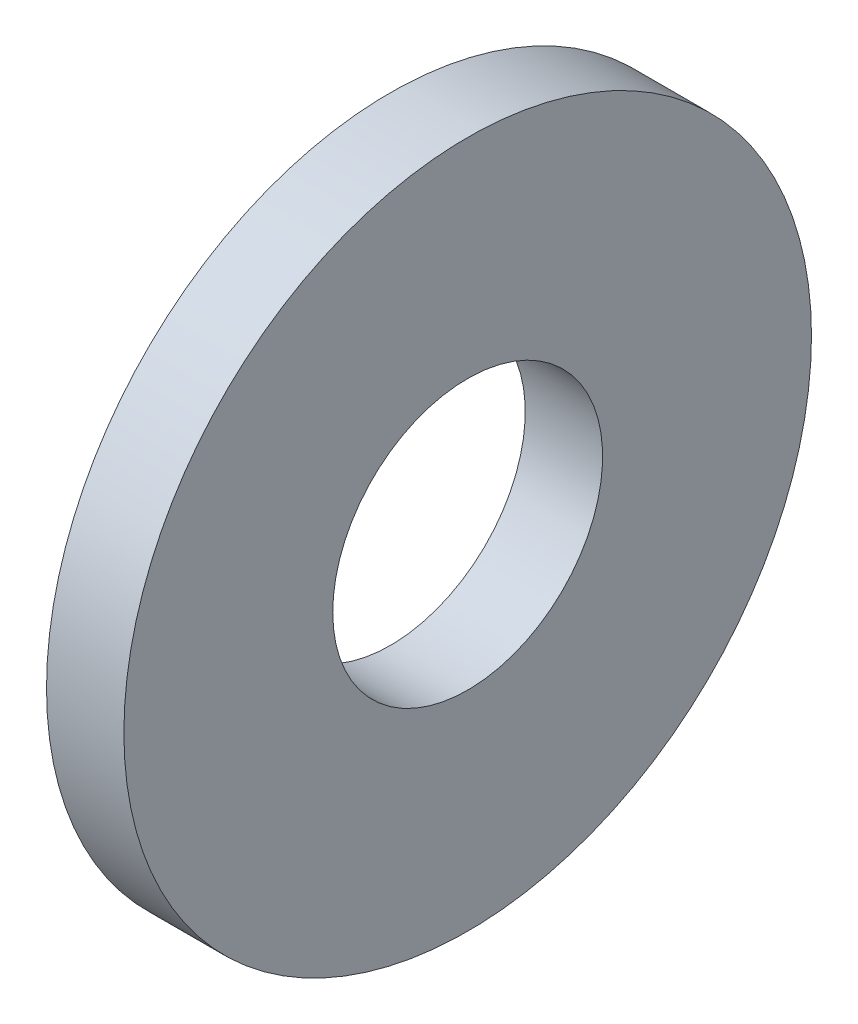
from build123d import *

# Parameters (mm, degrees)
SKETCH1_W = 0.9
SKETCH1_H = 2.43


with BuildPart() as part:
    # Sketch1 → Base-Revolve (revolve)
    with BuildSketch(Plane.XY, mode=Mode.PRIVATE) as base_revolve_sk:
        with Locations((-0.45, 2.785)):
            Rectangle(SKETCH1_W, SKETCH1_H)
    revolve(base_revolve_sk.sketch.rotate(Axis((-34.925, 0, 0), (1, 0, 0)), 90), axis=Axis((-34.925, 0, 0), (1, 0, 0)))


solid = part.part
